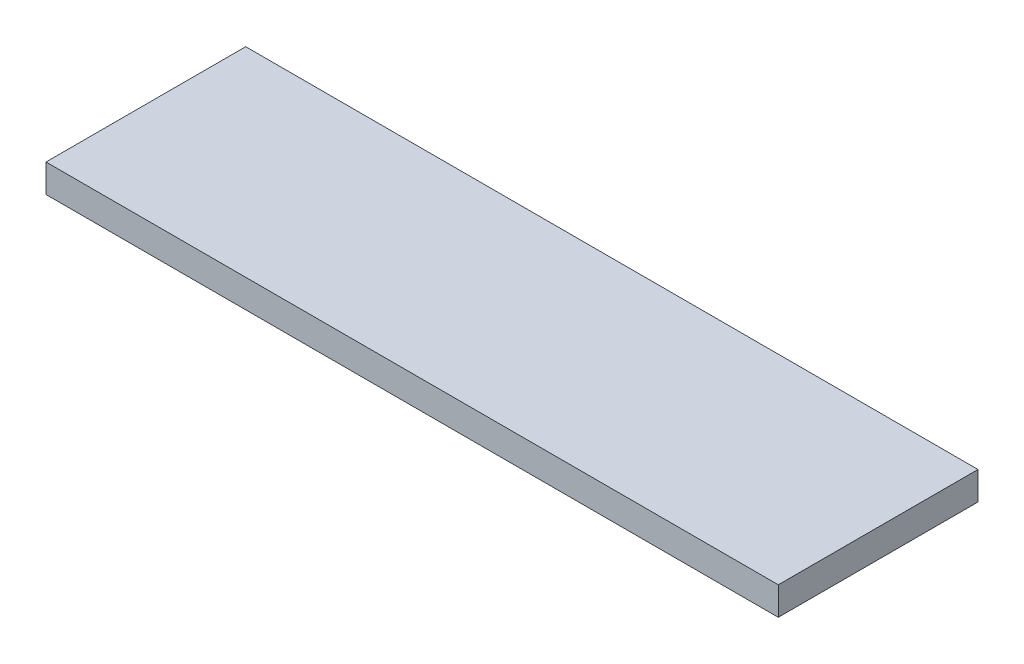
from build123d import *

# Parameters (mm, degrees)
SKETCH1_W           = 165
SKETCH1_H           = 45
BOSS_EXTRUDE1_DEPTH = 6.35


with BuildPart() as part:
    # Sketch1 → Boss-Extrude1 (new body)
    with BuildSketch(Plane(origin=(0, 0, 0), x_dir=(1, 0, 0), z_dir=(0, 1, 0))):
        Rectangle(SKETCH1_W, SKETCH1_H)
    extrude(amount=BOSS_EXTRUDE1_DEPTH)


solid = part.part
